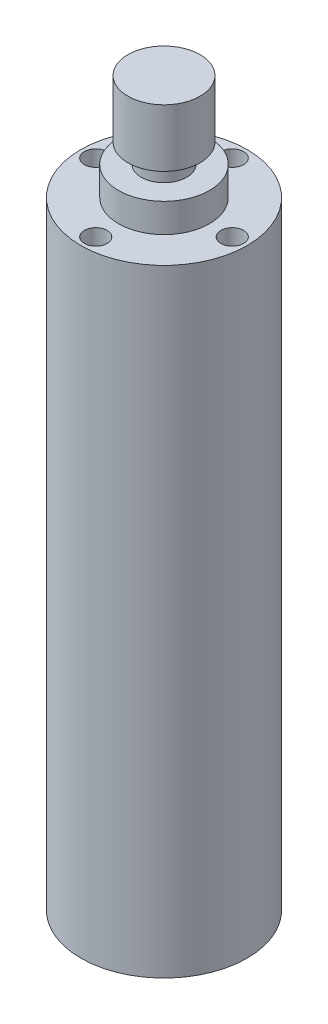
from build123d import *

# Parameters (mm, degrees)
SKETCH1_R           = 10.9855
BOSS_EXTRUDE1_DEPTH = 40.767
SKETCH2_R           = 6.0071
BOSS_EXTRUDE2_DEPTH = 3.81
SKETCH3_R           = 2.9972
BOSS_EXTRUDE3_DEPTH = 2.54
SKETCH4_R           = 4.7625
BOSS_EXTRUDE4_DEPTH = 7.62
SKETCH5_R           = 1.5
CUT_EXTRUDE1_DEPTH  = 7.62
CIRPATTERN1_COUNT   = 4


with BuildPart() as part:
    # Sketch1 → Boss-Extrude1 (new, symmetric)
    with BuildSketch(Plane(origin=(0, 0, 0), x_dir=(1, 0, 0), z_dir=(0, 1, 0))):
        with Locations(Location((0, 0, 0), (0, 0, 270))):
            Circle(SKETCH1_R)
    extrude(amount=BOSS_EXTRUDE1_DEPTH, both=True)

    # Sketch2 → Boss-Extrude2 (add)
    with BuildSketch(Plane(origin=(0, 40.767, 0), x_dir=(1, 0, 0), z_dir=(0, 1, 0))):
        with Locations(Location((0, 0, 0), (0, 0, 90))):
            Circle(SKETCH2_R)
    extrude(amount=BOSS_EXTRUDE2_DEPTH)

    # Sketch3 → Boss-Extrude3 (add)
    with BuildSketch(Plane(origin=(0, 44.577, 0), x_dir=(1, 0, 0), z_dir=(0, 1, 0))):
        with Locations(Location((0, 0, 0), (0, 0, 270))):
            Circle(SKETCH3_R)
    extrude(amount=BOSS_EXTRUDE3_DEPTH)

    # Sketch4 → Boss-Extrude4 (add)
    with BuildSketch(Plane(origin=(0, 47.117, 0), x_dir=(1, 0, 0), z_dir=(0, 1, 0))):
        with Locations(Location((0, 0, 0), (0, 0, 90))):
            Circle(SKETCH4_R)
    extrude(amount=BOSS_EXTRUDE4_DEPTH)

    # Sketch5 → Cut-Extrude1 (cut)
    with BuildSketch(Plane(origin=(0, 40.767, 0), x_dir=(1, 0, 0), z_dir=(0, 1, 0))):
        with Locations(Location((0, 9.017, 0), (0, 0, 270))):
            Circle(SKETCH5_R)
    cut_extrude1 = extrude(amount=-CUT_EXTRUDE1_DEPTH, mode=Mode.SUBTRACT)

    # CirPattern1: Cut-Extrude1 ×4 about axis
    cirpattern1_axis = Axis((0, 0, 0), (0, 1, 0))
    for i in range(1, CIRPATTERN1_COUNT):
        add(cut_extrude1.rotate(cirpattern1_axis, i * 360 / CIRPATTERN1_COUNT), mode=Mode.SUBTRACT)


solid = part.part
